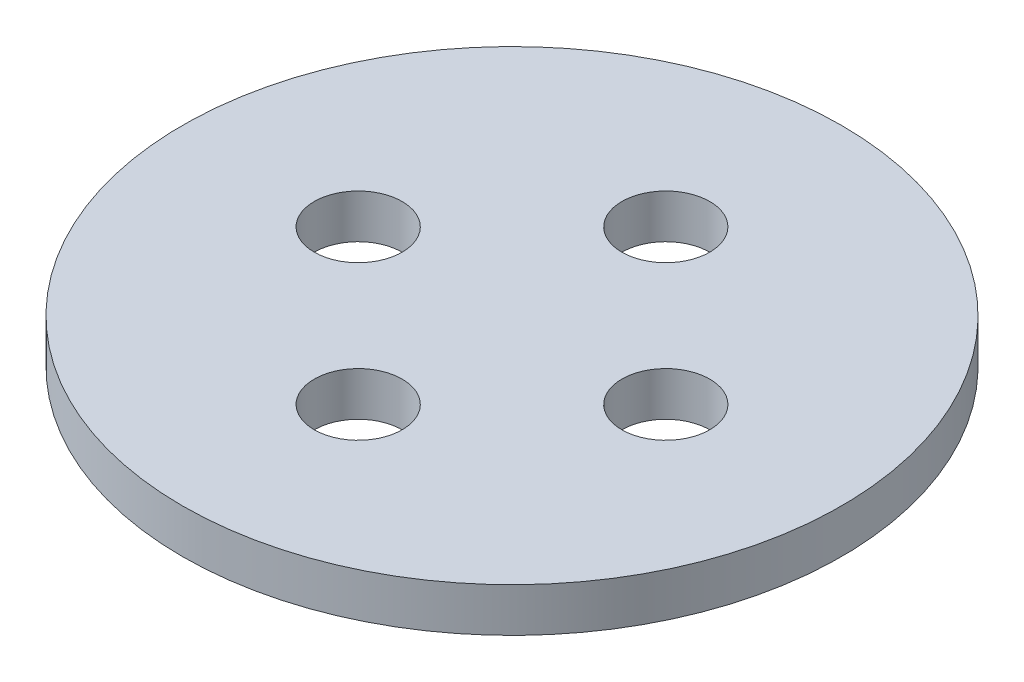
from build123d import *

# Parameters (mm, degrees)
SKETCH1_R           = 15
SKETCH1_R_2         = 2
BOSS_EXTRUDE1_DEPTH = 2


with BuildPart() as part:
    # Sketch1 → Boss-Extrude1 (new body)
    with BuildSketch(Plane(origin=(0, 0, 0), x_dir=(1, 0, 0), z_dir=(0, 1, 0))):
        with Locations(Location((0, 0, 0), (0, 0, 270))):
            Circle(SKETCH1_R)
        with Locations(Location((0, 7, 0), (0, 0, 270))):
            Circle(SKETCH1_R_2, mode=Mode.SUBTRACT)
        with Locations(Location((7, 0, 0), (0, 0, 270))):
            Circle(SKETCH1_R_2, mode=Mode.SUBTRACT)
        with Locations(Location((0, -7, 0), (0, 0, 270))):
            Circle(SKETCH1_R_2, mode=Mode.SUBTRACT)
        with Locations(Location((-7, 0, 0), (0, 0, 270))):
            Circle(SKETCH1_R_2, mode=Mode.SUBTRACT)
    extrude(amount=BOSS_EXTRUDE1_DEPTH)


solid = part.part
